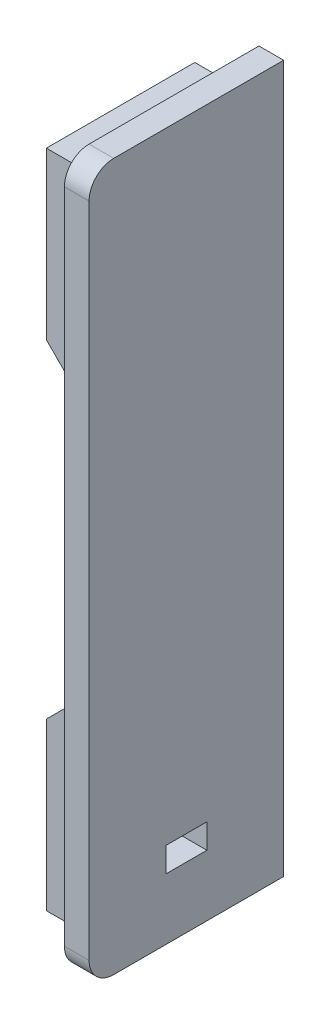
from build123d import *

# Parameters (mm, degrees)
BOSS_EXTRUDE1_DEPTH     = 3
SKETCH2_W               = 5
SKETCH2_H               = 3
CUT_EXTRUDE1_DEPTH      = 45.699303997
SKETCH3_W               = 18.054262684
SKETCH3_H               = 80.34146894
BOSS_EXTRUDE2_DEPTH     = 5
SKETCH5_W               = 11.91581337
SKETCH5_H               = 76.008445896
CUT_EXTRUDE2_DEPTH      = 5
CUT_EXTRUDE3_DEPTH      = 45.877920827
CUT_EXTRUDE3_DEPTH_BACK = 45.877920827
SKETCH7_W               = 2
SKETCH7_H               = 9
BOSS_EXTRUDE3_DEPTH     = 5
CUT_EXTRUDE4_DEPTH      = 5
SKETCH9_W               = 2.534423144
SKETCH9_H               = 2
CUT_EXTRUDE5_DEPTH      = 1
CUT_EXTRUDE6_DEPTH      = 2
BOSS_EXTRUDE5_DEPTH     = 2
BOSS_EXTRUDE6_DEPTH     = 2
CUT_EXTRUDE7_START      = -2
CUT_EXTRUDE7_DEPTH      = 2


with BuildPart() as part:
    # Sketch1 → Boss-Extrude1 (new body)
    with BuildSketch(Plane(origin=(0, 0, 0), x_dir=(0, 0, -1), z_dir=(1, 0, 0))):
        with BuildLine():
            Line((-8.833333333, -43), (11.833333333, -43))
            Line((11.833333333, -43), (11.833333333, 43))
            Line((11.833333333, 43), (-8.833333333, 43))
            ThreePointArc((-8.833333333, 43), (-10.954653677, 42.121320344), (-11.833333333, 40))
            Line((-11.833333333, 40), (-11.833333333, -40))
            ThreePointArc((-11.833333333, -40), (-10.954653677, -42.121320344), (-8.833333333, -43))
        make_face()
    extrude(amount=BOSS_EXTRUDE1_DEPTH)

    # Sketch2 → Cut-Extrude1 (cut, through all)
    with BuildSketch(Plane(origin=(3, 0, 0), x_dir=(0, 0, -1), z_dir=(1, 0, 0))):
        with Locations((0, -34.060962647)):
            Rectangle(SKETCH2_W, SKETCH2_H)
    extrude(amount=-CUT_EXTRUDE1_DEPTH, mode=Mode.SUBTRACT)

    # Sketch3 → Boss-Extrude2 (add)
    with BuildSketch(Plane.ZY):
        Rectangle(SKETCH3_W, SKETCH3_H)
    extrude(amount=BOSS_EXTRUDE2_DEPTH)

    # Sketch5 → Cut-Extrude2 (cut)
    with BuildSketch(Plane.ZY.offset(5)):
        Rectangle(SKETCH5_W, SKETCH5_H)
    extrude(amount=-CUT_EXTRUDE2_DEPTH, mode=Mode.SUBTRACT)

    # Sketch6 → Cut-Extrude3 (cut, two sides: drawn at the far end of the back side and taken through both)
    with BuildSketch(Plane.XY.offset(-CUT_EXTRUDE3_DEPTH_BACK)):
        Polygon((-5, -19.974207963), (-1.714874455, -16.689082418), (-1.714874455, 16.689082418), (-5, 19.974207963), align=None)
    extrude(amount=CUT_EXTRUDE3_DEPTH + CUT_EXTRUDE3_DEPTH_BACK, mode=Mode.SUBTRACT)

    # Sketch7 → Boss-Extrude3 (add)
    with BuildSketch(Plane.ZY):
        Rectangle(SKETCH7_W, SKETCH7_H)
    extrude(amount=BOSS_EXTRUDE3_DEPTH)

    # Sketch8 → Cut-Extrude4 (cut)
    with BuildSketch(Plane.XY.offset(1)):
        with BuildLine():
            ThreePointArc((-5, -0.459578833), (-2.44210099, -2.530530169), (0, -0.32421434))
            Line((0, -0.32421434), (0, 0.32421434))
            ThreePointArc((0, 0.32421434), (-2.44210099, 2.530530169), (-5, 0.459578833))
            Line((-5, 0.459578833), (-5, -0.459578833))
        make_face()
        with BuildLine():
            Line((-5, -4.5), (-2.510609776, -4.5))
            ThreePointArc((-2.510609776, -4.5), (-3.81075192, -4.308088951), (-5, -3.748724625))
            Line((-5, -3.748724625), (-5, -4.5))
        make_face()
        with BuildLine():
            Line((-2.510609776, -4.5), (0, -4.5))
            Line((0, -4.5), (0, -3.734546632))
            ThreePointArc((0, -3.734546632), (-1.198256898, -4.304384965), (-2.510609776, -4.5))
        make_face()
        with BuildLine():
            ThreePointArc((-2.510609794, 4.5), (-1.198256907, 4.304384967), (0, 3.734546632))
            Line((0, 3.734546632), (0, 4.5))
            Line((0, 4.5), (-2.510609794, 4.5))
        make_face()
        with BuildLine():
            ThreePointArc((-5, 3.748724625), (-3.810751929, 4.308088948), (-2.510609794, 4.5))
            Line((-2.510609794, 4.5), (-5, 4.5))
            Line((-5, 4.5), (-5, 3.748724625))
        make_face()
    extrude(amount=-CUT_EXTRUDE4_DEPTH, mode=Mode.SUBTRACT)

    # Sketch9 → Cut-Extrude5 (cut)
    with BuildSketch(Plane.ZY.offset(5)):
        Rectangle(SKETCH9_W, SKETCH9_H)
    extrude(amount=-CUT_EXTRUDE5_DEPTH, mode=Mode.SUBTRACT)

    # Sketch12 → Cut-Extrude6 (cut)
    with BuildSketch(Plane.XY.offset(1)):
        with BuildLine():
            Line((-4.836179898, -1), (-5, -1))
            Line((-5, -1), (-5, -3.748724625))
            ThreePointArc((-5, -3.748724625), (-2.497849634, -4.499981909), (0, -3.734546632))
            Line((0, -3.734546632), (0, -0.32421434))
            ThreePointArc((0, -0.32421434), (-2.160279243, -2.507098902), (-4.836179898, -1))
        make_face()
        with BuildLine():
            Line((-5, 3.748724625), (-5, 1))
            Line((-5, 1), (-4.836179898, 1))
            ThreePointArc((-4.836179898, 1), (-2.160279243, 2.507098902), (0, 0.32421434))
            Line((0, 0.32421434), (0, 3.734546632))
            ThreePointArc((0, 3.734546632), (-2.497849634, 4.499981909), (-5, 3.748724625))
        make_face()
    extrude(amount=-CUT_EXTRUDE6_DEPTH, mode=Mode.SUBTRACT)

    # Sketch10 → Boss-Extrude5 (add)
    with BuildSketch(Plane.XY.offset(1)):
        with BuildLine():
            Line((0.632034053, -1.144834058), (-0.193, -4.453864907))
            ThreePointArc((-0.193, -4.453864907), (-2.801828378, -4.592278965), (-5.047908598, -3.258012274))
            Line((-5.047908598, -3.258012274), (-4.41989103, -0.739171385))
            Line((-4.41989103, -0.739171385), (-4.335953587, -0.66680401))
            ThreePointArc((-4.335953587, -0.66680401), (-2.053682052, -3.002243354), (0.632034053, -1.144834058))
        make_face()
        with BuildLine():
            Line((-5.047908598, 3.258012274), (-4.41989103, 0.739171385))
            Line((-4.41989103, 0.739171385), (-4.335953587, 0.66680401))
            ThreePointArc((-4.335953587, 0.66680401), (-2.053682052, 3.002243354), (0.632034053, 1.144834058))
            Line((0.632034053, 1.144834058), (-0.193, 4.453864907))
            ThreePointArc((-0.193, 4.453864907), (-2.801828378, 4.592278965), (-5.047908598, 3.258012274))
        make_face()
    extrude(amount=-BOSS_EXTRUDE5_DEPTH)

    # Sketch13 → Boss-Extrude6 (add)
    with BuildSketch(Plane(origin=(0, 0, -1), x_dir=(-1, 0, 0), z_dir=(0, 0, -1))):
        Polygon((0, 3.679784186), (0.193, 4.453864907), (-0.617433114, 4.244828064), (-0.739085506, -4.079345447), (0.193, -4.453864907), (0, -3.679784186), (0, -2.250971384), (0, 2.250971384), align=None)
    extrude(amount=-BOSS_EXTRUDE6_DEPTH)

    # Sketch15 → Cut-Extrude7 (cut)
    with BuildSketch(Plane(origin=(0, 0, -1), x_dir=(-1, 0, 0), z_dir=(0, 0, -1)).offset(CUT_EXTRUDE7_START)):
        Polygon((4.65583066, 1.685473556), (5.047908598, 3.258012274), (4.038538563, 1.685473556), align=None)
        with BuildLine():
            Line((4.65583066, 1.685473556), (4.038538563, 1.685473556))
            ThreePointArc((4.038538563, 1.685473556), (4.241224486, 1.191898546), (4.335953587, 0.66680401))
            Line((4.335953587, 0.66680401), (4.41989103, 0.739171385))
            Line((4.41989103, 0.739171385), (4.65583066, 1.685473556))
        make_face()
        with BuildLine():
            ThreePointArc((4.335953587, -0.66680401), (4.241224486, -1.191898546), (4.038538563, -1.685473556))
            Line((4.038538563, -1.685473556), (4.65583066, -1.685473556))
            Line((4.65583066, -1.685473556), (4.41989103, -0.739171385))
            Line((4.41989103, -0.739171385), (4.335953587, -0.66680401))
        make_face()
        Polygon((4.65583066, -1.685473556), (4.038538563, -1.685473556), (5.047908598, -3.258012274), align=None)
    extrude(amount=CUT_EXTRUDE7_DEPTH, mode=Mode.SUBTRACT)


solid = part.part
